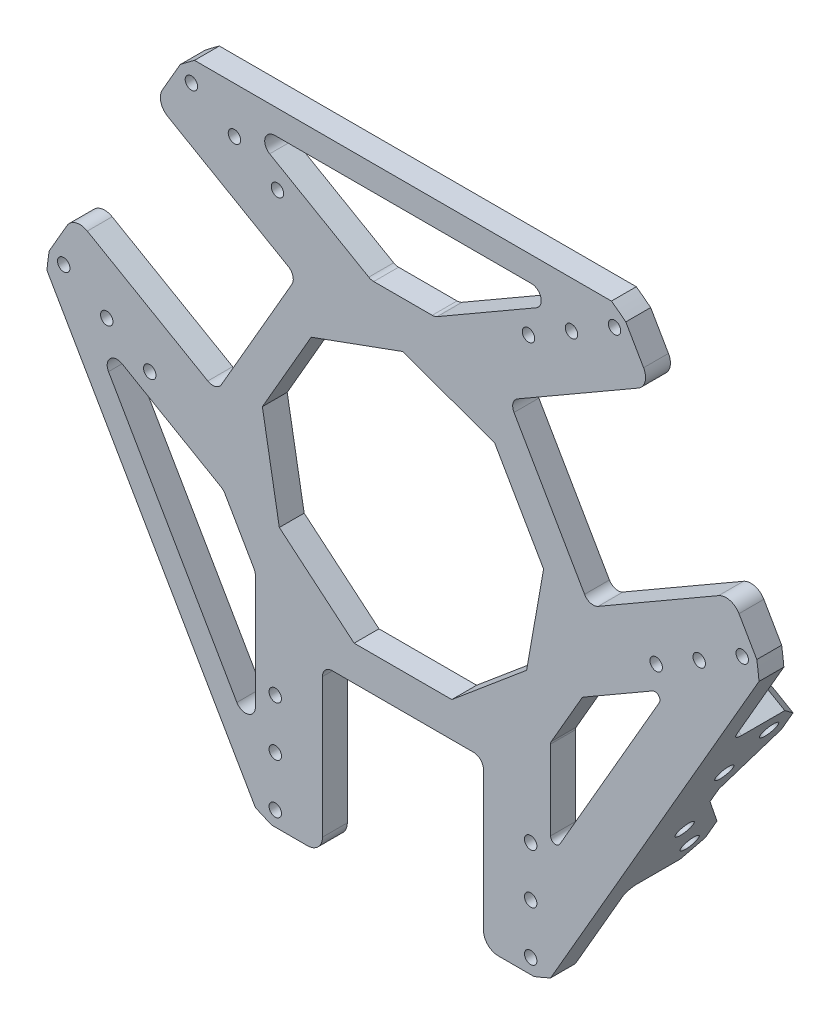
from build123d import *

# Parameters (mm, degrees)
SKETCH_1_R          = 72
SKETCH_1_R_2        = 1.25
EXTRUDE_1_DEPTH     = 5
CUT_EXTRUDE_START   = -10
CUT_EXTRUDE_2_DEPTH = 10
CUT_EXTRUDE_3_DEPTH = 10
EXTRUDE_2_DEPTH     = 5
CUT_EXTRUDE_4_DEPTH = 6
CUT_EXTRUDE_5_DEPTH = 10
FILLET_1_R          = 3
EXTRUDE_3_DEPTH     = 5
SKETCH_13_R         = 1.75
EXTRUDE_4_DEPTH     = 5
FILLET_2_R          = 2
CUT_EXTRUDE_6_DEPTH = 5
FILLET_3_R          = 2


with BuildPart() as part:
    # 草图1 → 凸台-拉伸1 (new body)
    with BuildSketch(Plane.XY):
        Circle(SKETCH_1_R)
        with Locations((25.7, -64)):
            Circle(SKETCH_1_R_2, mode=Mode.SUBTRACT)
        with Locations((25.7, -54)):
            Circle(SKETCH_1_R_2, mode=Mode.SUBTRACT)
        with Locations((25.7, -44)):
            Circle(SKETCH_1_R_2, mode=Mode.SUBTRACT)
        with Locations(Location((-25.7, -44, 0), (0, 0, 180))):
            Circle(SKETCH_1_R_2, mode=Mode.SUBTRACT)
        with Locations(Location((-25.7, -54, 0), (0, 0, 180))):
            Circle(SKETCH_1_R_2, mode=Mode.SUBTRACT)
        with Locations(Location((-25.7, -64, 0), (0, 0, 180))):
            Circle(SKETCH_1_R_2, mode=Mode.SUBTRACT)
        with Locations(Location((-25.255117767, 44.256852877, 0), (0, 0, 180))):
            Circle(SKETCH_1_R_2, mode=Mode.SUBTRACT)
        with Locations(Location((-33.915371804, 49.256852877, 0), (0, 0, 180))):
            Circle(SKETCH_1_R_2, mode=Mode.SUBTRACT)
        with Locations(Location((-42.575625842, 54.256852877, 0), (0, 0, 180))):
            Circle(SKETCH_1_R_2, mode=Mode.SUBTRACT)
        with Locations((-50.955117767, -0.256852877)):
            Circle(SKETCH_1_R_2, mode=Mode.SUBTRACT)
        with Locations((-59.615371804, 4.743147123)):
            Circle(SKETCH_1_R_2, mode=Mode.SUBTRACT)
        with Locations((-68.275625842, 9.743147123)):
            Circle(SKETCH_1_R_2, mode=Mode.SUBTRACT)
        with Locations(Location((50.955117767, -0.256852877, 0), (0, 0, 180))):
            Circle(SKETCH_1_R_2, mode=Mode.SUBTRACT)
        with Locations(Location((59.615371804, 4.743147123, 0), (0, 0, 180))):
            Circle(SKETCH_1_R_2, mode=Mode.SUBTRACT)
        with Locations(Location((68.275625842, 9.743147123, 0), (0, 0, 180))):
            Circle(SKETCH_1_R_2, mode=Mode.SUBTRACT)
        with Locations((25.255117767, 44.256852877)):
            Circle(SKETCH_1_R_2, mode=Mode.SUBTRACT)
        with Locations((33.915371804, 49.256852877)):
            Circle(SKETCH_1_R_2, mode=Mode.SUBTRACT)
        with Locations((42.575625842, 54.256852877)):
            Circle(SKETCH_1_R_2, mode=Mode.SUBTRACT)
    extrude(amount=EXTRUDE_1_DEPTH)

    # 草图3 → 切除-拉伸2 (cut)
    with BuildSketch(Plane.XY.offset(5).offset(CUT_EXTRUDE_START)):
        with BuildLine():
            Line((16.2, -36), (16.2, -70.153830972))
            ThreePointArc((16.2, -70.153830972), (0, -72), (-16.2, -70.153830972))
            Line((-16.2, -70.153830972), (-16.2, -36))
            ThreePointArc((-16.2, -36), (-15.614213562, -34.585786438), (-14.2, -34))
            Line((-14.2, -34), (14.2, -34))
            ThreePointArc((14.2, -34), (15.614213562, -34.585786438), (16.2, -36))
        make_face()
        with BuildLine():
            Line((-23.076914536, 32.029611541), (-52.654999794, 49.106527027))
            ThreePointArc((-52.654999794, 49.106527027), (-62.353829072, 36), (-68.854999794, 21.047303945))
            Line((-68.854999794, 21.047303945), (-39.276914536, 3.970388459))
            ThreePointArc((-39.276914536, 3.970388459), (-37.759276446, 3.770587614), (-36.544863729, 4.702439266))
            Line((-36.544863729, 4.702439266), (-22.344863729, 29.297560734))
            ThreePointArc((-22.344863729, 29.297560734), (-22.145062884, 30.815198824), (-23.076914536, 32.029611541))
        make_face()
        with BuildLine():
            Line((39.276914536, 3.970388459), (68.854999794, 21.047303945))
            ThreePointArc((68.854999794, 21.047303945), (62.353829072, 36), (52.654999794, 49.106527027))
            Line((52.654999794, 49.106527027), (23.076914536, 32.029611541))
            ThreePointArc((23.076914536, 32.029611541), (22.145062884, 30.815198824), (22.344863729, 29.297560734))
            Line((22.344863729, 29.297560734), (36.544863729, 4.702439266))
            ThreePointArc((36.544863729, 4.702439266), (37.759276446, 3.770587614), (39.276914536, 3.970388459))
        make_face()
    extrude(amount=CUT_EXTRUDE_2_DEPTH, mode=Mode.SUBTRACT)

    # 草图5 → 切除-拉伸3 (cut)
    with BuildSketch(Plane.XY.offset(5).offset(CUT_EXTRUDE_START)):
        with BuildLine():
            Line((-41.951694517, 58.515428112), (-6.417930688, 38))
            Line((-6.417930688, 38), (6.417930688, 38))
            Line((6.417930688, 38), (41.951694517, 58.515428112))
            ThreePointArc((41.951694517, 58.515428112), (0, 72), (-41.951694517, 58.515428112))
        make_face()
        with BuildLine():
            Line((71.651694517, 7.073519127), (36.117930688, -13.441908985))
            Line((36.117930688, -13.441908985), (29.7, -24.558091015))
            Line((29.7, -24.558091015), (29.7, -65.58894724))
            ThreePointArc((29.7, -65.58894724), (62.353829072, -36), (71.651694517, 7.073519127))
        make_face()
        with BuildLine():
            Line((-29.7, -65.58894724), (-29.7, -24.558091015))
            Line((-29.7, -24.558091015), (-36.117930688, -13.441908985))
            Line((-36.117930688, -13.441908985), (-71.651694517, 7.073519127))
            ThreePointArc((-71.651694517, 7.073519127), (-62.353829072, -36), (-29.7, -65.58894724))
        make_face()
    extrude(amount=CUT_EXTRUDE_3_DEPTH, mode=Mode.SUBTRACT)

    # 草图6 → 凸台-拉伸2 (add)
    with BuildSketch(Plane.XY.offset(5)):
        Polygon((-71.651694517, 7.073519127), (-29.7, -65.58894724), (-29.7, -55.58894724), (-62.991440479, 2.073519127), align=None)
        Polygon((33.291440479, 53.515428112), (41.951694517, 58.515428112), (-41.951694517, 58.515428112), (-33.291440479, 53.515428112), align=None)
        Polygon((29.7, -55.58894724), (29.7, -65.58894724), (71.651694517, 7.073519127), (62.991440479, 2.073519127), align=None)
    extrude(amount=-EXTRUDE_2_DEPTH)

    # 草图7 → 切除-拉伸4 (cut)
    with BuildSketch(Plane.XY.offset(5)):
        Polygon((-24.883334598, -14.366399928), (-9.827196325, -27), (9.827196325, -27), (24.883334598, -14.366399928), (28.296284065, 4.989398334), (18.46908774, 22.010601666), (0, 28.732799857), (-18.46908774, 22.010601666), (-28.296284065, 4.989398334), align=None)
    extrude(amount=-CUT_EXTRUDE_4_DEPTH, mode=Mode.SUBTRACT)

    # 草图10 → 切除-拉伸5 (cut)
    with BuildSketch(Plane.XY.offset(5).offset(CUT_EXTRUDE_START)):
        with BuildLine():
            Line((-44.842275727, 56.330900114), (-49.923702054, 47.529611541))
            Line((-49.923702054, 47.529611541), (-52.654999794, 49.106527027))
            ThreePointArc((-52.654999794, 49.106527027), (-48.882282835, 52.863242663), (-44.842275727, 56.330900114))
        make_face()
        with BuildLine():
            Line((-68.854999794, 21.047303945), (-66.123702054, 19.470388459))
            Line((-66.123702054, 19.470388459), (-71.20512838, 10.669099886))
            ThreePointArc((-71.20512838, 10.669099886), (-70.22205249, 15.901677398), (-68.854999794, 21.047303945))
        make_face()
        with BuildLine():
            Line((52.654999794, 49.106527027), (49.923702054, 47.529611541))
            Line((49.923702054, 47.529611541), (44.842275727, 56.330900114))
            ThreePointArc((44.842275727, 56.330900114), (48.882282835, 52.863242663), (52.654999794, 49.106527027))
        make_face()
        with BuildLine():
            Line((66.123702054, 19.470388459), (68.854999794, 21.047303945))
            ThreePointArc((68.854999794, 21.047303945), (70.22205249, 15.901677398), (71.20512838, 10.669099886))
            Line((71.20512838, 10.669099886), (66.123702054, 19.470388459))
        make_face()
        with BuildLine():
            Line((16.2, -70.153830972), (16.2, -67))
            Line((16.2, -67), (26.362852653, -67))
            ThreePointArc((26.362852653, -67), (21.339769655, -68.764920061), (16.2, -70.153830972))
        make_face()
        with BuildLine():
            Line((-16.2, -67), (-16.2, -70.153830972))
            ThreePointArc((-16.2, -70.153830972), (-21.339769655, -68.764920061), (-26.362852653, -67))
            Line((-26.362852653, -67), (-16.2, -67))
        make_face()
    extrude(amount=CUT_EXTRUDE_5_DEPTH, mode=Mode.SUBTRACT)

    # 圆角1
    fillet_1_edges = [part.edges().sort_by_distance(p)[0] for p in [
        (16.2, -67, 2.5),
        (-16.2, -67, 2.5),
        (-66.123702054, 19.470388459, 2.5),
        (-49.923702054, 47.529611541, 2.5),
        (49.923702054, 47.529611541, 2.5),
        (66.123702054, 19.470388459, 2.5),
    ]]
    fillet(fillet_1_edges, radius=FILLET_1_R)

    # 草图12 → 凸台-拉伸3 (add)
    with BuildSketch(Plane(origin=(0, 0, 0), x_dir=(-1, 0, 0), z_dir=(0, 0, -1))):
        Polygon((-29.7, -24.558091015), (-29.7, -55.58894724), (-62.991440479, 2.073519127), (-36.117930688, -13.441908985), align=None)
    extrude(amount=-EXTRUDE_3_DEPTH)

    # 草图13 → 凸台-拉伸4 (add)
    with BuildSketch(Plane(origin=(50.675847258, -29.257714056, 0), x_dir=(0, 0, -1), z_dir=(0.8660254037844392, -0.49999999999999906, 0))):
        Polygon((0, 21), (10.656854249, 21), (14, 17.656854249), (14, 12.966018868), (7, 1.766018868), (7, -1.766018868), (14, -12.966018868), (14, -17.656854249), (10.656854249, -21), (0, -21), align=None)
        with Locations(Location((5, 8, 0), (0, 0, 90))):
            Circle(SKETCH_13_R, mode=Mode.SUBTRACT)
        with Locations(Location((10, 16, 0), (0, 0, 90))):
            Circle(SKETCH_13_R, mode=Mode.SUBTRACT)
        with Locations(Location((5, -8, 0), (0, 0, 270))):
            Circle(SKETCH_13_R, mode=Mode.SUBTRACT)
        with Locations(Location((10, -16, 0), (0, 0, 270))):
            Circle(SKETCH_13_R, mode=Mode.SUBTRACT)
    extrude(amount=-EXTRUDE_4_DEPTH)

    # 圆角2
    fillet_2_edges = [part.edges().sort_by_distance(p)[0] for p in [
        (46.34572024, -26.757714056, 0),
        (38.010783749, -46.194247536, 0),
        (59.010783749, -9.821180577, 0),
    ]]
    fillet(fillet_2_edges, radius=FILLET_2_R)

    # 草图14 → 切除-拉伸6 (cut)
    with BuildSketch(Plane(origin=(0, 0, 0), x_dir=(-1, 0, 0), z_dir=(0, 0, -1))):
        with BuildLine():
            Line((-29.7, -24.826040208), (-29.7, -40.826040208))
            ThreePointArc((-29.7, -40.826040208), (-30.441180955, -41.791966034), (-31.566025404, -41.326040208))
            Line((-31.566025404, -41.326040208), (-51.57241336, -6.673959792))
            ThreePointArc((-51.57241336, -6.673959792), (-51.413494737, -5.466853011), (-50.206387956, -5.307934389))
            Line((-50.206387956, -5.307934389), (-36.349981495, -13.307934389))
            ThreePointArc((-36.349981495, -13.307934389), (-36.142874714, -13.466853011), (-35.983956091, -13.673959792))
            Line((-35.983956091, -13.673959792), (-29.833974596, -24.326040208))
            ThreePointArc((-29.833974596, -24.326040208), (-29.734074174, -24.567221163), (-29.7, -24.826040208))
        make_face()
    extrude(amount=-CUT_EXTRUDE_6_DEPTH, mode=Mode.SUBTRACT)

    # 圆角3
    fillet_3_edges = [part.edges().sort_by_distance(p)[0] for p in [
        (6.417930688, 38, 2.5),
        (-6.417930688, 38, 2.5),
        (-36.117930688, -13.441908985, 2.5),
        (-29.7, -24.558091015, 2.5),
        (-62.991440479, 2.073519127, 2.5),
        (-29.7, -55.58894724, 2.5),
        (33.291440479, 53.515428112, 2.5),
        (-33.291440479, 53.515428112, 2.5),
    ]]
    fillet(fillet_3_edges, radius=FILLET_3_R)


solid = part.part
